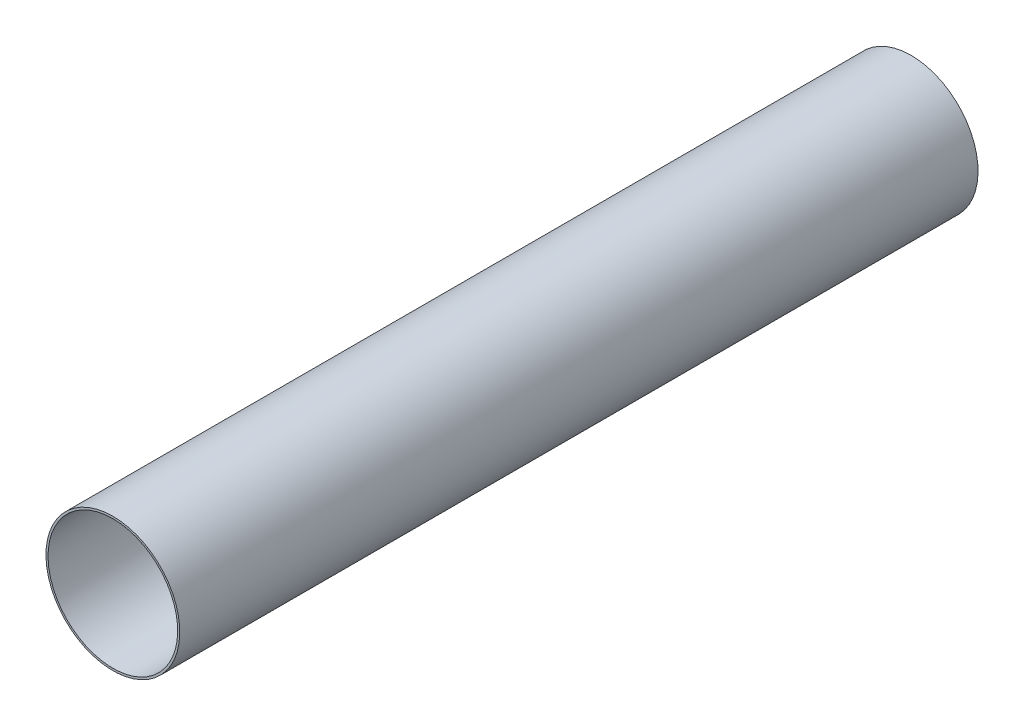
from build123d import *

# Parameters (mm, degrees)
ESQUISSE2_W = 610
ESQUISSE2_H = 1.58


with BuildPart() as part:
    # Esquisse2 → Révolution1 (revolve)
    with BuildSketch(Plane(origin=(0, 0, 0), x_dir=(0, 0, -1), z_dir=(1, 0, 0))):
        with Locations((-315, 50.32)):
            Rectangle(ESQUISSE2_W, ESQUISSE2_H)
    revolve(axis=Axis((0, 0, 0), (0, 0, 1)))


solid = part.part
